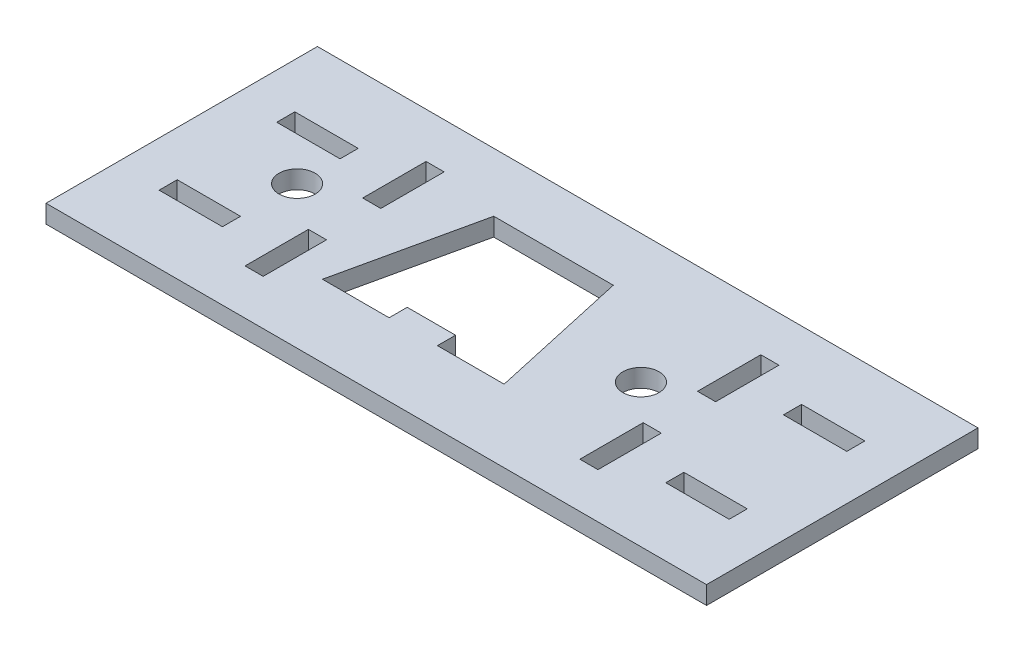
from build123d import *

# Parameters (mm, degrees)
SKETCH1_W           = 73
SKETCH1_H           = 30
SKETCH1_W_2         = 7
SKETCH1_H_2         = 2
SKETCH1_W_3         = 2
SKETCH1_H_3         = 7
BOSS_EXTRUDE1_DEPTH = 2
CUT_EXTRUDE1_DEPTH  = 10
SKETCH6_R           = 2
CUT_EXTRUDE2_DEPTH  = 19


with BuildPart() as part:
    # Sketch1 → Boss-Extrude1 (new body)
    with BuildSketch(Plane(origin=(0, 0, 0), x_dir=(1, 0, 0), z_dir=(0, 1, 0))):
        with Locations((-11.269774173, -9.91409445)):
            Rectangle(SKETCH1_W, SKETCH1_H)
        with Locations((-39.269774173, -16.41409445)):
            Rectangle(SKETCH1_W_2, SKETCH1_H_2, mode=Mode.SUBTRACT)
        with Locations((-39.269774173, -3.41409445)):
            Rectangle(SKETCH1_W_2, SKETCH1_H_2, mode=Mode.SUBTRACT)
        with Locations((16.730225827, -3.41409445)):
            Rectangle(SKETCH1_W_2, SKETCH1_H_2, mode=Mode.SUBTRACT)
        with Locations((16.730225827, -16.41409445)):
            Rectangle(SKETCH1_W_2, SKETCH1_H_2, mode=Mode.SUBTRACT)
        with Locations((-29.769774173, -3.41409445)):
            Rectangle(SKETCH1_W_3, SKETCH1_H_3, mode=Mode.SUBTRACT)
        with Locations((-29.769774173, -16.41409445)):
            Rectangle(SKETCH1_W_3, SKETCH1_H_3, mode=Mode.SUBTRACT)
        with Locations((7.230225827, -16.41409445)):
            Rectangle(SKETCH1_W_3, SKETCH1_H_3, mode=Mode.SUBTRACT)
        with Locations((7.230225827, -3.41409445)):
            Rectangle(SKETCH1_W_3, SKETCH1_H_3, mode=Mode.SUBTRACT)
    extrude(amount=BOSS_EXTRUDE1_DEPTH)

    # Sketch3 → Cut-Extrude1 (cut)
    with BuildSketch(Plane(origin=(0, 2, 0), x_dir=(1, 0, 0), z_dir=(0, 1, 0))):
        Polygon((-20.17963908, -3.41409445), (-22.7291277, -14.91409445), (-17.850525272, -14.91409445), (-12.508752888, -14.91409445), (-7.630150459, -14.91409445), (-10.17963908, -3.41409445), align=None)
        Polygon((-5.138202105, -16.91409445), (-12.508752888, -16.91409445), (-12.508752888, -14.91409445), (-7.630150459, -14.91409445), (-10.17963908, -3.41409445), (-20.17963908, -3.41409445), (-22.7291277, -14.91409445), (-17.850525272, -14.91409445), (-17.850525272, -16.91409445), (-25.221076054, -16.91409445), (-21.784808783, -1.41409445), (-8.574469376, -1.41409445), align=None)
    extrude(amount=-CUT_EXTRUDE1_DEPTH, mode=Mode.SUBTRACT)

    # Sketch6 → Cut-Extrude2 (cut)
    with BuildSketch(Plane(origin=(0, 2, 0), x_dir=(1, 0, 0), z_dir=(0, 1, 0))):
        with Locations(Location((-35.769774173, -9.16409445, 0), (0, 0, 270))):
            Circle(SKETCH6_R)
        with Locations(Location((2.230225827, -9.16409445, 0), (0, 0, 270))):
            Circle(SKETCH6_R)
    extrude(amount=-CUT_EXTRUDE2_DEPTH, mode=Mode.SUBTRACT)


solid = part.part
